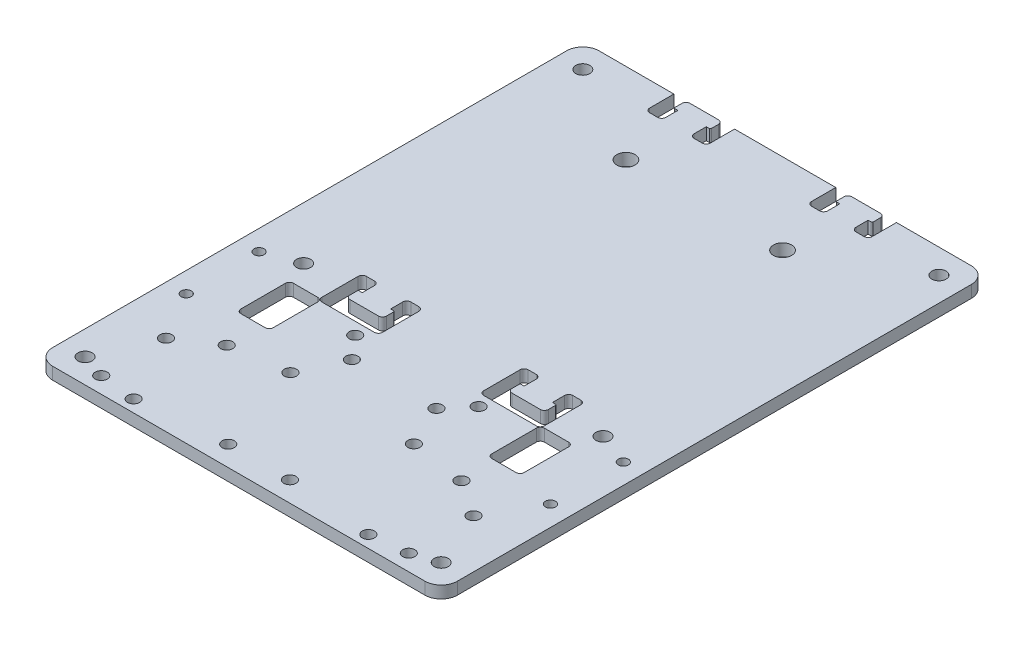
from build123d import *

# Parameters (mm, degrees)
SKETCH1_W                  = 100
SKETCH1_H                  = 135
STOCK_DEPTH                = 3
BASE_ROUNDS_R              = 4
SKETCH2_R                  = 1.75
HOLES_LAYERS_DEPTH         = 85.055041491
SKETCH4_R                  = 1.5
HOLES_INTERFACEBOARD_DEPTH = 85.055041491
SKETCH3_R                  = 1.25
HOLES_MOTORBRACKET_DEPTH   = 85.055041491
HOLES_MOTORWIRES_DEPTH     = 85.055041491
SKETCH5_R                  = 2.25
HOLES_BALLCASTER_DEPTH     = 85.055041491
SKETCH6_R                  = 1.5
HOLES_COLOR_IRSENSOR_DEPTH = 85.055041491
STRAPHOLE_POWERBANK_DEPTH  = 85.055041491
SKETCH7_R                  = 1.5
HOLES_PI_DEPTH             = 85.055041491
SKETCH10_R                 = 1.5
HOLES_DCDC_DEPTH           = 85.055041491
SKETCH13_R                 = 1.5
HOLES_IMU_DEPTH            = 85.055041491


with BuildPart() as part:
    # Sketch1 → Stock (new body)
    with BuildSketch(Plane(origin=(0, 0, 0), x_dir=(1, 0, 0), z_dir=(0, 1, 0))):
        Rectangle(SKETCH1_W, SKETCH1_H)
    extrude(amount=-STOCK_DEPTH)

    # base-rounds
    base_rounds_edges = [part.edges().sort_by_distance(p)[0] for p in [
        (50, -1.5, 67.5),
        (50, -1.5, -67.5),
        (-50, -1.5, -67.5),
        (-50, -1.5, 67.5),
    ]]
    fillet(base_rounds_edges, radius=BASE_ROUNDS_R)

    # Sketch2 → holes-layers (cut, through all)
    with BuildSketch(Plane(origin=(0, 0, 0), x_dir=(1, 0, 0), z_dir=(0, 1, 0))):
        with Locations((-44, -61.5)):
            Circle(SKETCH2_R)
        with Locations((-44, 61.5)):
            Circle(SKETCH2_R)
        with Locations((44, -61.5)):
            Circle(SKETCH2_R)
        with Locations((44, 61.5)):
            Circle(SKETCH2_R)
        with Locations((-37, -14.5)):
            Circle(SKETCH2_R)
        with Locations((37, -14.5)):
            Circle(SKETCH2_R)
    extrude(amount=-HOLES_LAYERS_DEPTH, mode=Mode.SUBTRACT)

    # Sketch4 → holes-interfaceboard (cut, through all)
    with BuildSketch(Plane(origin=(0, 0, 0), x_dir=(1, 0, 0), z_dir=(0, 1, 0))):
        with Locations((-38, -63.5)):
            Circle(SKETCH4_R)
        with Locations((-38, -47.5)):
            Circle(SKETCH4_R)
        with Locations((38, -47.5)):
            Circle(SKETCH4_R)
        with Locations((38, -63.5)):
            Circle(SKETCH4_R)
    extrude(amount=-HOLES_INTERFACEBOARD_DEPTH, mode=Mode.SUBTRACT)

    # Sketch3 → holes-motorbracket (cut, through all)
    with BuildSketch(Plane(origin=(0, 0, 0), x_dir=(1, 0, 0), z_dir=(0, 1, 0))):
        with Locations((-45, -35.5)):
            Circle(SKETCH3_R)
        with Locations((-45, -17.5)):
            Circle(SKETCH3_R)
        with Locations((45, -17.5)):
            Circle(SKETCH3_R)
        with Locations((45, -35.5)):
            Circle(SKETCH3_R)
    extrude(amount=-HOLES_MOTORBRACKET_DEPTH, mode=Mode.SUBTRACT)

    # Sketch11 → holes-motorwires (cut, through all)
    with BuildSketch(Plane(origin=(0, 0, 0), x_dir=(1, 0, 0), z_dir=(0, 1, 0))):
        with BuildLine():
            Line((-34, -20), (-28, -20))
            ThreePointArc((-28, -20), (-27.292893219, -20.292893219), (-27, -21))
            Line((-27, -21), (-27, -32))
            ThreePointArc((-27, -32), (-27.292893219, -32.707106781), (-28, -33))
            Line((-28, -33), (-34, -33))
            ThreePointArc((-34, -33), (-34.707106781, -32.707106781), (-35, -32))
            Line((-35, -32), (-35, -21))
            ThreePointArc((-35, -21), (-34.707106781, -20.292893219), (-34, -20))
        make_face()
        with BuildLine():
            Line((27, -21), (27, -32))
            ThreePointArc((27, -32), (27.292893219, -32.707106781), (28, -33))
            Line((28, -33), (34, -33))
            ThreePointArc((34, -33), (34.707106781, -32.707106781), (35, -32))
            Line((35, -32), (35, -21))
            ThreePointArc((35, -21), (34.707106781, -20.292893219), (34, -20))
            Line((34, -20), (28, -20))
            ThreePointArc((28, -20), (27.292893219, -20.292893219), (27, -21))
        make_face()
    extrude(amount=-HOLES_MOTORWIRES_DEPTH, mode=Mode.SUBTRACT)

    # Sketch5 → holes-ballcaster (cut, through all)
    with BuildSketch(Plane(origin=(0, 0, 0), x_dir=(1, 0, 0), z_dir=(0, 1, 0))):
        with Locations((-19.35, 47.5)):
            Circle(SKETCH5_R)
        with Locations((19.35, 47.5)):
            Circle(SKETCH5_R)
    extrude(amount=-HOLES_BALLCASTER_DEPTH, mode=Mode.SUBTRACT)

    # Sketch6 → holes-color/irsensor (cut, through all)
    with BuildSketch(Plane(origin=(0, 0, 0), x_dir=(1, 0, 0), z_dir=(0, 1, 0))):
        with Locations((-7.62, -62.5)):
            Circle(SKETCH6_R)
        with Locations((7.62, -62.5)):
            Circle(SKETCH6_R)
    extrude(amount=-HOLES_COLOR_IRSENSOR_DEPTH, mode=Mode.SUBTRACT)

    # Sketch8 → straphole-powerbank (cut, through all)
    with BuildSketch(Plane(origin=(0, 0, 0), x_dir=(1, 0, 0), z_dir=(0, 1, 0))):
        with BuildLine():
            Line((-15.5, -9.5), (-13.5, -9.5))
            ThreePointArc((-13.5, -9.5), (-12.792893219, -9.792893219), (-12.5, -10.5))
            Line((-12.5, -10.5), (-12.5, -19.5))
            ThreePointArc((-12.5, -19.5), (-12.792893219, -20.207106781), (-13.5, -20.5))
            Line((-13.5, -20.5), (-26.5, -20.5))
            ThreePointArc((-26.5, -20.5), (-27.207106781, -20.207106781), (-27.5, -19.5))
            Line((-27.5, -19.5), (-27.5, -10.5))
            ThreePointArc((-27.5, -10.5), (-27.207106781, -9.792893219), (-26.5, -9.5))
            Line((-26.5, -9.5), (-24.5, -9.5))
            ThreePointArc((-24.5, -9.5), (-23.792893219, -9.792893219), (-23.5, -10.5))
            Line((-23.5, -10.5), (-23.5, -13.5))
            Line((-23.5, -13.5), (-24.25, -13.5))
            ThreePointArc((-24.25, -13.5), (-24.426776695, -13.573223305), (-24.5, -13.75))
            Line((-24.5, -13.75), (-24.5, -15.5))
            ThreePointArc((-24.5, -15.5), (-24.207106781, -16.207106781), (-23.5, -16.5))
            Line((-23.5, -16.5), (-16.5, -16.5))
            ThreePointArc((-16.5, -16.5), (-15.792893219, -16.207106781), (-15.5, -15.5))
            Line((-15.5, -15.5), (-15.5, -13.75))
            ThreePointArc((-15.5, -13.75), (-15.573223305, -13.573223305), (-15.75, -13.5))
            Line((-15.75, -13.5), (-16.5, -13.5))
            Line((-16.5, -13.5), (-16.5, -10.5))
            ThreePointArc((-16.5, -10.5), (-16.207106781, -9.792893219), (-15.5, -9.5))
        make_face()
        with BuildLine():
            Line((15.5, -15.5), (15.5, -13.75))
            ThreePointArc((15.5, -13.75), (15.573223305, -13.573223305), (15.75, -13.5))
            Line((15.75, -13.5), (16.5, -13.5))
            Line((16.5, -13.5), (16.5, -10.5))
            ThreePointArc((16.5, -10.5), (16.207106781, -9.792893219), (15.5, -9.5))
            Line((15.5, -9.5), (13.5, -9.5))
            ThreePointArc((13.5, -9.5), (12.792893219, -9.792893219), (12.5, -10.5))
            Line((12.5, -10.5), (12.5, -19.5))
            ThreePointArc((12.5, -19.5), (12.792893219, -20.207106781), (13.5, -20.5))
            Line((13.5, -20.5), (26.5, -20.5))
            ThreePointArc((26.5, -20.5), (27.207106781, -20.207106781), (27.5, -19.5))
            Line((27.5, -19.5), (27.5, -10.5))
            ThreePointArc((27.5, -10.5), (27.207106781, -9.792893219), (26.5, -9.5))
            Line((26.5, -9.5), (24.5, -9.5))
            ThreePointArc((24.5, -9.5), (23.792893219, -9.792893219), (23.5, -10.5))
            Line((23.5, -10.5), (23.5, -13.5))
            Line((23.5, -13.5), (24.25, -13.5))
            ThreePointArc((24.25, -13.5), (24.426776695, -13.573223305), (24.5, -13.75))
            Line((24.5, -13.75), (24.5, -15.5))
            ThreePointArc((24.5, -15.5), (24.207106781, -16.207106781), (23.5, -16.5))
            Line((23.5, -16.5), (16.5, -16.5))
            ThreePointArc((16.5, -16.5), (15.792893219, -16.207106781), (15.5, -15.5))
        make_face()
        with BuildLine():
            Line((-15.5, 66.5), (-15.5, 64.75))
            ThreePointArc((-15.5, 64.75), (-15.573223305, 64.573223305), (-15.75, 64.5))
            Line((-15.75, 64.5), (-16.5, 64.5))
            Line((-16.5, 64.5), (-16.5, 61.5))
            ThreePointArc((-16.5, 61.5), (-16.207106781, 60.792893219), (-15.5, 60.5))
            Line((-15.5, 60.5), (-13.5, 60.5))
            ThreePointArc((-13.5, 60.5), (-12.792893219, 60.792893219), (-12.5, 61.5))
            Line((-12.5, 61.5), (-12.5, 70.5))
            ThreePointArc((-12.5, 70.5), (-12.792893219, 71.207106781), (-13.5, 71.5))
            Line((-13.5, 71.5), (-26.5, 71.5))
            ThreePointArc((-26.5, 71.5), (-27.207106781, 71.207106781), (-27.5, 70.5))
            Line((-27.5, 70.5), (-27.5, 61.5))
            ThreePointArc((-27.5, 61.5), (-27.207106781, 60.792893219), (-26.5, 60.5))
            Line((-26.5, 60.5), (-24.5, 60.5))
            ThreePointArc((-24.5, 60.5), (-23.792893219, 60.792893219), (-23.5, 61.5))
            Line((-23.5, 61.5), (-23.5, 64.5))
            Line((-23.5, 64.5), (-24.25, 64.5))
            ThreePointArc((-24.25, 64.5), (-24.426776695, 64.573223305), (-24.5, 64.75))
            Line((-24.5, 64.75), (-24.5, 66.5))
            ThreePointArc((-24.5, 66.5), (-24.207106781, 67.207106781), (-23.5, 67.5))
            Line((-23.5, 67.5), (-16.5, 67.5))
            ThreePointArc((-16.5, 67.5), (-15.792893219, 67.207106781), (-15.5, 66.5))
        make_face()
        with BuildLine():
            Line((15.5, 60.5), (13.5, 60.5))
            ThreePointArc((13.5, 60.5), (12.792893219, 60.792893219), (12.5, 61.5))
            Line((12.5, 61.5), (12.5, 70.5))
            ThreePointArc((12.5, 70.5), (12.792893219, 71.207106781), (13.5, 71.5))
            Line((13.5, 71.5), (26.5, 71.5))
            ThreePointArc((26.5, 71.5), (27.207106781, 71.207106781), (27.5, 70.5))
            Line((27.5, 70.5), (27.5, 61.5))
            ThreePointArc((27.5, 61.5), (27.207106781, 60.792893219), (26.5, 60.5))
            Line((26.5, 60.5), (24.5, 60.5))
            ThreePointArc((24.5, 60.5), (23.792893219, 60.792893219), (23.5, 61.5))
            Line((23.5, 61.5), (23.5, 64.5))
            Line((23.5, 64.5), (24.25, 64.5))
            ThreePointArc((24.25, 64.5), (24.426776695, 64.573223305), (24.5, 64.75))
            Line((24.5, 64.75), (24.5, 66.5))
            ThreePointArc((24.5, 66.5), (24.207106781, 67.207106781), (23.5, 67.5))
            Line((23.5, 67.5), (16.5, 67.5))
            ThreePointArc((16.5, 67.5), (15.792893219, 67.207106781), (15.5, 66.5))
            Line((15.5, 66.5), (15.5, 64.75))
            ThreePointArc((15.5, 64.75), (15.573223305, 64.573223305), (15.75, 64.5))
            Line((15.75, 64.5), (16.5, 64.5))
            Line((16.5, 64.5), (16.5, 61.5))
            ThreePointArc((16.5, 61.5), (16.207106781, 60.792893219), (15.5, 60.5))
        make_face()
    extrude(amount=-STRAPHOLE_POWERBANK_DEPTH, mode=Mode.SUBTRACT)

    # Sketch7 → holes-pi (cut, through all)
    with BuildSketch(Plane(origin=(0, 0, 0), x_dir=(1, 0, 0), z_dir=(0, 1, 0))):
        with Locations((-29, -64.5)):
            Circle(SKETCH7_R)
        with Locations((-29, -41.5)):
            Circle(SKETCH7_R)
        with Locations((29, -64.5)):
            Circle(SKETCH7_R)
        with Locations((29, -41.5)):
            Circle(SKETCH7_R)
    extrude(amount=-HOLES_PI_DEPTH, mode=Mode.SUBTRACT)

    # Sketch10 → holes-dcdc (cut, through all)
    with BuildSketch(Plane(origin=(0, 0, 0), x_dir=(1, 0, 0), z_dir=(0, 1, 0))):
        with Locations((-15.25, -23.5)):
            Circle(SKETCH10_R)
        with Locations((15.25, -39.5)):
            Circle(SKETCH10_R)
        with Locations((-15.25, -39.5)):
            Circle(SKETCH10_R)
        with Locations((15.25, -23.5)):
            Circle(SKETCH10_R)
    extrude(amount=-HOLES_DCDC_DEPTH, mode=Mode.SUBTRACT)

    # Sketch13 → holes-IMU (cut, through all)
    with BuildSketch(Plane(origin=(0, 0, 0), x_dir=(1, 0, 0), z_dir=(0, 1, 0))):
        with Locations((-10.44998, -29.12)):
            Circle(SKETCH13_R)
        with Locations((10.44998, -29.12)):
            Circle(SKETCH13_R)
    extrude(amount=-HOLES_IMU_DEPTH, mode=Mode.SUBTRACT)


solid = part.part
